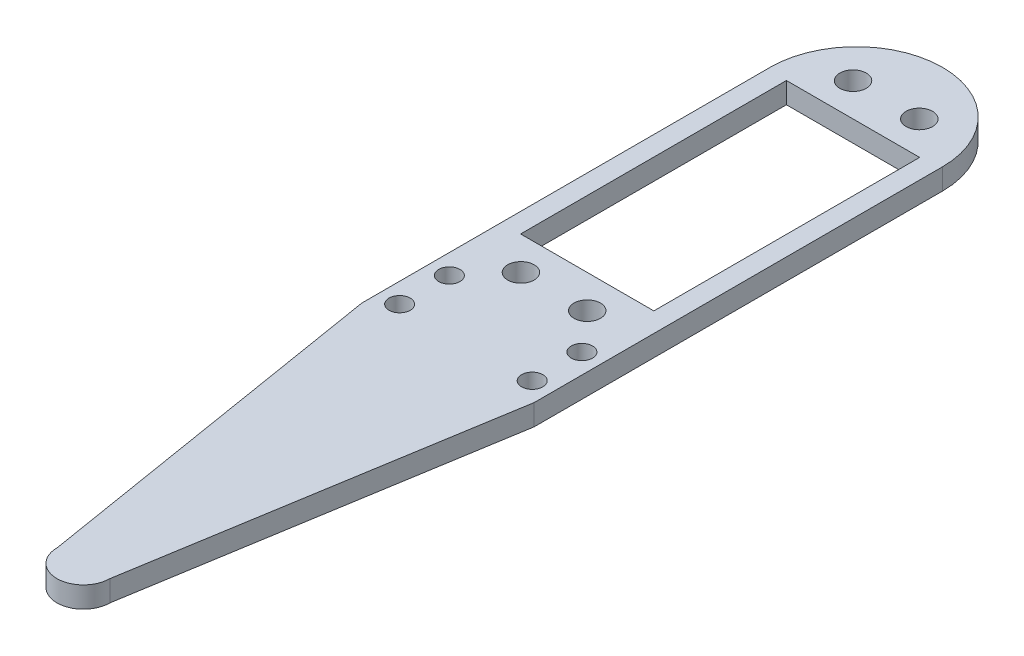
from build123d import *

# Parameters (mm, degrees)
SKETCH2_R               = 2
SKETCH2_W               = 20.1
SKETCH2_H               = 40.1
BOSS_EXTRUDE1_DEPTH     = 3.175
CUT_EXTRUDE1_DEPTH      = 122.340185532
CUT_EXTRUDE1_DEPTH_BACK = 122.340185532
SKETCH3_R               = 1.6


with BuildPart() as part:
    # Sketch2 → Boss-Extrude1 (new body)
    with BuildSketch(Plane(origin=(0, 0, 0), x_dir=(1, 0, 0), z_dir=(0, 1, 0))):
        with BuildLine():
            Line((-13, 0), (-13, -61.6))
            Line((-13, -61.6), (-4, -116.6))
            ThreePointArc((-4, -116.6), (0, -120.6), (4, -116.6))
            Line((4, -116.6), (13, -61.6))
            Line((13, -61.6), (13, 0))
            ThreePointArc((13, 0), (0, 13), (-13, 0))
        make_face()
        with Locations(Location((-5, 4.5, 0), (0, 0, 270))):
            Circle(SKETCH2_R, mode=Mode.SUBTRACT)
        with Locations(Location((-5, -45.6, 0), (0, 0, 270))):
            Circle(SKETCH2_R, mode=Mode.SUBTRACT)
        with Locations(Location((5, -45.6, 0), (0, 0, 90))):
            Circle(SKETCH2_R, mode=Mode.SUBTRACT)
        with Locations(Location((5, 4.5, 0), (0, 0, 90))):
            Circle(SKETCH2_R, mode=Mode.SUBTRACT)
        with Locations((0, -20.55)):
            Rectangle(SKETCH2_W, SKETCH2_H, mode=Mode.SUBTRACT)
    extrude(amount=BOSS_EXTRUDE1_DEPTH)

    # Sketch3 → Cut-Extrude1 (cut, two sides: drawn at the far end of the back side and taken through both)
    with BuildSketch(Plane(origin=(0, 3.175, 0), x_dir=(1, 0, 0), z_dir=(0, 1, 0)).offset(-CUT_EXTRUDE1_DEPTH_BACK)):
        with Locations(Location((10, -58.9, 0), (0, 0, 270))):
            Circle(SKETCH3_R)
        with Locations(Location((10, -51.4, 0), (0, 0, 270))):
            Circle(SKETCH3_R)
        with Locations(Location((-10, -58.9, 0), (0, 0, 270))):
            Circle(SKETCH3_R)
        with Locations(Location((-10, -51.4, 0), (0, 0, 270))):
            Circle(SKETCH3_R)
    extrude(amount=CUT_EXTRUDE1_DEPTH + CUT_EXTRUDE1_DEPTH_BACK, mode=Mode.SUBTRACT)


solid = part.part
